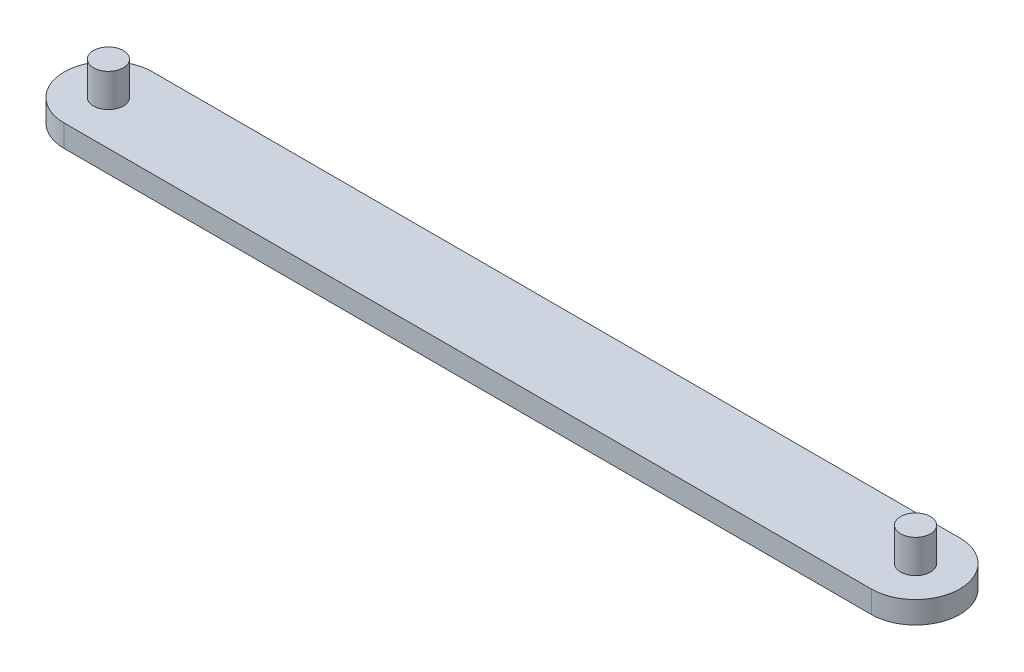
from build123d import *

# Parameters (mm, degrees)
BOSS_EXTRUDE1_DEPTH = 2
SKETCH3_R           = 1.35
BOSS_EXTRUDE2_DEPTH = 3


with BuildPart() as part:
    # Sketch2 → Boss-Extrude1 (new body)
    with BuildSketch(Plane(origin=(0, 0, 0), x_dir=(1, 0, 0), z_dir=(0, 1, 0))):
        with BuildLine():
            Line((-36.5, -4), (36.5, -4))
            ThreePointArc((36.5, -4), (40.5, 0), (36.5, 4))
            Line((36.5, 4), (-36.5, 4))
            ThreePointArc((-36.5, 4), (-40.5, 0), (-36.5, -4))
        make_face()
    extrude(amount=BOSS_EXTRUDE1_DEPTH)

    # Sketch3 → Boss-Extrude2 (add)
    with BuildSketch(Plane(origin=(0, 2, 0), x_dir=(1, 0, 0), z_dir=(0, 1, 0))):
        with Locations(Location((-36.5, 0, 0), (0, 0, 270))):
            Circle(SKETCH3_R)
        with Locations(Location((36.5, 0, 0), (0, 0, 90))):
            Circle(SKETCH3_R)
    extrude(amount=BOSS_EXTRUDE2_DEPTH)


solid = part.part
